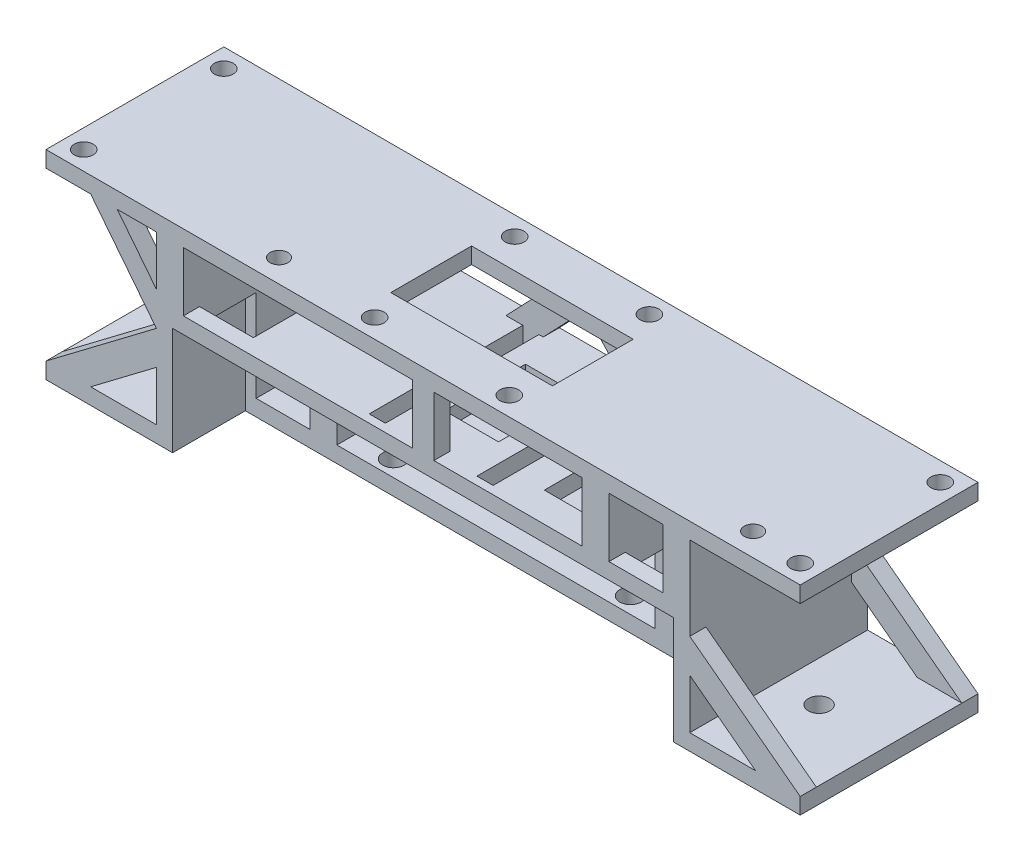
from build123d import *

# Parameters (mm, degrees)
SKETCH_1_W            = 140
SKETCH_1_H            = 33
EXTRUDE_1_DEPTH       = 3
HOLE_WIZARD_1_D       = 3.5
SKETCH_5_W            = 10
SKETCH_5_H            = 33
EXTRUDE_2_DEPTH       = 31
SKETCH_6_W            = 140
SKETCH_6_H            = 33
EXTRUDE_3_DEPTH       = 3
HOLE_WIZARD_2_D       = 4
HOLE_WIZARD_2_DEPTH   = 3
EXTRUDE_7_DEPTH       = 3
MIRROR_4_COPY_1_DEPTH = 3
EXTRUDE_8_DEPTH       = 3
SKETCH_12_W           = 10
SKETCH_12_H           = 31
CUT_EXTRUDE_1_DEPTH   = 85.528101836
SKETCH_14_W           = 18
SKETCH_14_H           = 3.3
CUT_EXTRUDE_3_DEPTH   = 3
SKETCH_17_W           = 30
SKETCH_17_H           = 15
CUT_EXTRUDE_5_DEPTH   = 5
SKETCH_22_W           = 15
SKETCH_22_H           = 15.5
CUT_EXTRUDE_6_DEPTH   = 3
SKETCH_23_W           = 93
SKETCH_23_H           = 20
CUT_EXTRUDE_7_DEPTH   = 13.5
SKETCH_24_W           = 59
SKETCH_24_H           = 14
CUT_EXTRUDE_8_DEPTH   = 3
SKETCH_26_W           = 59
SKETCH_26_H           = 3
EXTRUDE_9_DEPTH       = 33
SKETCH_27_W           = 1.5
SKETCH_27_H           = 28.5
CUT_EXTRUDE_9_DEPTH   = 3
SKETCH_28_W           = 10
SKETCH_28_H           = 3
EXTRUDE_10_DEPTH      = 3
SKETCH_29_W           = 10
SKETCH_29_H           = 15
CUT_EXTRUDE_10_DEPTH  = 3
SKETCH_30_W           = 4
SKETCH_30_H           = 11
EXTRUDE_11_DEPTH      = 3
CUT_EXTRUDE_11_REACH  = 77.507
SKETCH_31_W           = 7
SKETCH_31_H           = 11
SKETCH_35_W           = 5
SKETCH_35_H           = 11
CUT_EXTRUDE_12_DEPTH  = 13.5
HOLE_WIZARD_3_D       = 3.3
HOLE_WIZARD_3_DEPTH   = 3


with BuildPart() as part:
    # 草图1 → 凸台-拉伸1 (new body)
    with BuildSketch(Plane(origin=(0, 0, 0), x_dir=(1, 0, 0), z_dir=(0, 1, 0))):
        Rectangle(SKETCH_1_W, SKETCH_1_H)
    extrude(amount=EXTRUDE_1_DEPTH)

    # 孔1 (through all)
    with Locations(Plane(origin=(0, 3, 0), x_dir=(1, 0, 0), z_dir=(0, 1, 0))):
        with Locations((-66.5, 13), (-12.5, 13), (-12.5, -13), (-66.5, -13)):
            hole_wizard_1 = Hole(HOLE_WIZARD_1_D / 2)

    # 镜向1: 孔1 across plane
    add(hole_wizard_1.mirror(Plane.ZY), mode=Mode.SUBTRACT)

    # 草图5 → 凸台-拉伸2 (add)
    with BuildSketch(Plane.XZ):
        with Locations((-44.5, 0)):
            Rectangle(SKETCH_5_W, SKETCH_5_H)
        with Locations((-34.5, 0)):
            Rectangle(SKETCH_5_W, SKETCH_5_H)
        with Locations((34.5, 0)):
            Rectangle(SKETCH_5_W, SKETCH_5_H)
        with Locations((44.5, 0)):
            Rectangle(SKETCH_5_W, SKETCH_5_H)
    extrude(amount=EXTRUDE_2_DEPTH)

    # 草图6 → 凸台-拉伸3 (add)
    with BuildSketch(Plane.XZ.offset(31)):
        Rectangle(SKETCH_6_W, SKETCH_6_H)
    extrude(amount=EXTRUDE_3_DEPTH)

    # 孔2
    with Locations(Plane(origin=(0, -34, 0), x_dir=(-1, 0, 0), z_dir=(0, -1, 0))):
        with Locations((57, 0), (22, 0)):
            hole_wizard_2 = Hole(HOLE_WIZARD_2_D / 2, depth=HOLE_WIZARD_2_DEPTH)

    # 镜向2: 孔2 across plane
    add(hole_wizard_2.mirror(Plane.ZY), mode=Mode.SUBTRACT)

    # 草图10 → 凸台-拉伸7 (add)
    with BuildSketch(Plane.XY.offset(16.5)):
        Polygon((-61.709614661, 0), (-49.5, -15.5), (-49.5, -9.231659865), align=None)
        Polygon((-61.709614661, 0), (-49.5, -9.231659865), (-56.771936106, 0), align=None)
        Polygon((-49.5, -15.5), (-70, -31), (-61.709614661, -31), (-49.5, -21.768340135), align=None)
    extrude_7 = extrude(amount=-EXTRUDE_7_DEPTH)

    # 镜向3: 凸台-拉伸7 across plane
    add(extrude_7.mirror(Plane.XY))

    # 镜向4: 凸台-拉伸7 across plane
    add(extrude_7.mirror(Plane.ZY))

    # 镜向4 copy 1 sketch → 镜向4 copy 1 (add)
    with BuildSketch(Plane(origin=(0, 0, -16.5), x_dir=(-1, 0, 0), z_dir=(0, 0, -1))):
        Polygon((-61.709614661, 0), (-49.5, -15.5), (-49.5, -9.231659865), align=None)
        Polygon((-61.709614661, 0), (-49.5, -9.231659865), (-56.771936106, 0), align=None)
        Polygon((-49.5, -15.5), (-70, -31), (-61.709614661, -31), (-49.5, -21.768340135), align=None)
    extrude(amount=-MIRROR_4_COPY_1_DEPTH)

    # 草图11 → 凸台-拉伸8 (add)
    with BuildSketch(Plane.XY.offset(16.5)):
        Polygon((-1.380422804, -1.450613794), (-29.5, -31), (-26.739154392, -31), (0, -2.901227588), align=None)
        Polygon((-29.5, -26.648158618), (-29.5, -31), (-1.380422804, -1.450613794), (0, 0), (-4.141268412, 0), align=None)
        Polygon((0, 0), (-1.380422804, -1.450613794), (0, -2.901227588), (1.380422804, -1.450613794), align=None)
        Polygon((1.380422804, -1.450613794), (0, -2.901227588), (26.739154392, -31), (29.5, -31), align=None)
        Polygon((4.141268412, 0), (0, 0), (1.380422804, -1.450613794), (29.5, -31), (29.5, -26.648158618), align=None)
    extrude_8 = extrude(amount=-EXTRUDE_8_DEPTH)

    # 镜向5: 凸台-拉伸8 across plane
    add(extrude_8.mirror(Plane.XY))

    # 草图12 → 切除-拉伸1 (cut, through all)
    with BuildSketch(Plane.XY.offset(16.5)):
        with Locations((-39.5, -15.5)):
            Rectangle(SKETCH_12_W, SKETCH_12_H)
    cut_extrude_1 = extrude(amount=-CUT_EXTRUDE_1_DEPTH, mode=Mode.SUBTRACT)

    # 镜向6: 切除-拉伸1 across plane
    add(cut_extrude_1.mirror(Plane.ZY), mode=Mode.SUBTRACT)

    # 草图14 → 切除-拉伸3 (cut)
    with BuildSketch(Plane(origin=(0, -31, 0), x_dir=(1, 0, 0), z_dir=(0, 1, 0))):
        with Locations((0, -9.5)):
            Rectangle(SKETCH_14_W, SKETCH_14_H)
    extrude(amount=-CUT_EXTRUDE_3_DEPTH, mode=Mode.SUBTRACT)

    # 草图17 → 切除-拉伸5 (cut)
    with BuildSketch(Plane(origin=(0, 3, 0), x_dir=(1, 0, 0), z_dir=(0, 1, 0))):
        Rectangle(SKETCH_17_W, SKETCH_17_H)
    extrude(amount=-CUT_EXTRUDE_5_DEPTH, mode=Mode.SUBTRACT)

    # 草图22 → 切除-拉伸6 (cut)
    with BuildSketch(Plane.XY.offset(16.5)):
        with Locations((57, -7.75)):
            Rectangle(SKETCH_22_W, SKETCH_22_H)
    extrude(amount=-CUT_EXTRUDE_6_DEPTH, mode=Mode.SUBTRACT)

    # 草图23 → 切除-拉伸7 (cut)
    with BuildSketch(Plane.XY.offset(16.5)):
        with Locations((0, -24)):
            Rectangle(SKETCH_23_W, SKETCH_23_H)
    extrude(amount=-CUT_EXTRUDE_7_DEPTH, mode=Mode.SUBTRACT)

    # 草图24 → 切除-拉伸8 (cut)
    with BuildSketch(Plane.XY.offset(16.5)):
        with Locations((0, -7)):
            Rectangle(SKETCH_24_W, SKETCH_24_H)
    extrude(amount=-CUT_EXTRUDE_8_DEPTH, mode=Mode.SUBTRACT)

    # 草图26 → 凸台-拉伸9 (add)
    with BuildSketch(Plane.XY.offset(16.5)):
        with Locations((0, -12.5)):
            Rectangle(SKETCH_26_W, SKETCH_26_H)
    extrude(amount=-EXTRUDE_9_DEPTH)

    # 草图27 → 切除-拉伸9 (cut)
    with BuildSketch(Plane(origin=(0, -11, 0), x_dir=(1, 0, 0), z_dir=(0, 1, 0))):
        with Locations((-10.75, -0.75)):
            Rectangle(SKETCH_27_W, SKETCH_27_H)
        with Locations((-9.25, -0.75)):
            Rectangle(SKETCH_27_W, SKETCH_27_H)
        with Locations((9.25, -0.75)):
            Rectangle(SKETCH_27_W, SKETCH_27_H)
        with Locations((10.75, -0.75)):
            Rectangle(SKETCH_27_W, SKETCH_27_H)
    extrude(amount=-CUT_EXTRUDE_9_DEPTH, mode=Mode.SUBTRACT)

    # 草图28 → 凸台-拉伸10 (add)
    with BuildSketch(Plane.XY.offset(16.5)):
        with Locations((-39.5, -12.5)):
            Rectangle(SKETCH_28_W, SKETCH_28_H)
        with Locations((39.5, -12.5)):
            Rectangle(SKETCH_28_W, SKETCH_28_H)
    extrude(amount=-EXTRUDE_10_DEPTH)

    # 草图29 → 切除-拉伸10 (cut)
    with BuildSketch(Plane(origin=(0, -11, 0), x_dir=(1, 0, 0), z_dir=(0, 1, 0))):
        Rectangle(SKETCH_29_W, SKETCH_29_H)
    extrude(amount=-CUT_EXTRUDE_10_DEPTH, mode=Mode.SUBTRACT)

    # 草图30 → 凸台-拉伸11 (add)
    with BuildSketch(Plane.XY.offset(16.5)):
        with Locations((0, -5.5)):
            Rectangle(SKETCH_30_W, SKETCH_30_H)
    extrude(amount=-EXTRUDE_11_DEPTH)

    # 草图31 → 切除-拉伸11 (cut, up to next)
    with BuildSketch(Plane(origin=(0, -11, 0), x_dir=(1, 0, 0), z_dir=(0, 1, 0)), mode=Mode.PRIVATE) as cut_extrude_11_sk1:
        with Locations((20.5, -5.5)):
            Rectangle(SKETCH_31_W, SKETCH_31_H)
    cut_extrude_11_tool1 = extrude(cut_extrude_11_sk1.sketch, amount=-CUT_EXTRUDE_11_REACH, mode=Mode.PRIVATE) & part.part
    # 草图31 → 切除-拉伸11 (cut, up to next)
    with BuildSketch(Plane(origin=(0, -11, 0), x_dir=(1, 0, 0), z_dir=(0, 1, 0)), mode=Mode.PRIVATE) as cut_extrude_11_sk2:
        with Locations((20.5, 5.5)):
            Rectangle(SKETCH_31_W, SKETCH_31_H)
    cut_extrude_11_tool2 = extrude(cut_extrude_11_sk2.sketch, amount=-CUT_EXTRUDE_11_REACH, mode=Mode.PRIVATE) & part.part
    add(cut_extrude_11_tool1.solids().sort_by_distance((20.5, -11, 5.5))[0], mode=Mode.SUBTRACT)
    add(cut_extrude_11_tool2.solids().sort_by_distance((20.5, -11, -5.5))[0], mode=Mode.SUBTRACT)

    # 草图35 → 切除-拉伸12 (cut)
    with BuildSketch(Plane.XY.offset(16.5)):
        with Locations((-32, -5.5)):
            Rectangle(SKETCH_35_W, SKETCH_35_H)
    extrude(amount=-CUT_EXTRUDE_12_DEPTH, mode=Mode.SUBTRACT)

    # 孔3
    with Locations(Plane(origin=(0, 3, 0), x_dir=(1, 0, 0), z_dir=(0, 1, 0))):
        with Locations((57, -12.25), (-31, -12.25)):
            Hole(HOLE_WIZARD_3_D / 2, depth=HOLE_WIZARD_3_DEPTH)


solid = part.part
